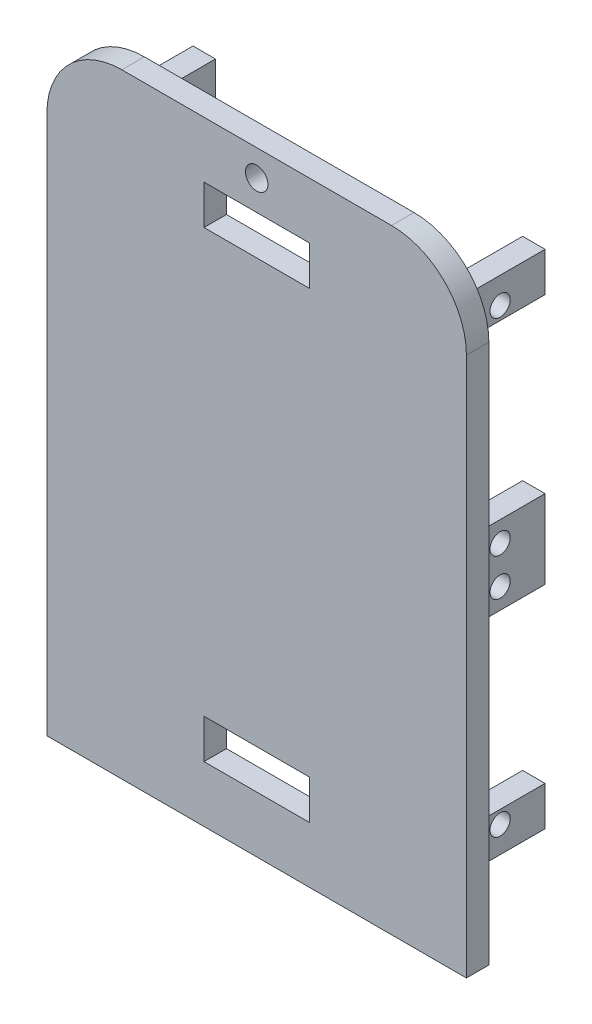
from build123d import *

# Parameters (mm, degrees)
SKETCH_1_W          = 48
SKETCH_1_H          = 67
EXTRUDE_2_DEPTH     = 3
SKETCH_3_W          = 3
SKETCH_3_H          = 67
SKETCH_3_H_2        = 66.995889348
EXTRUDE_3_DEPTH     = 12
SKETCH_4_R          = 1.35
SKETCH_4_W          = 12
SKETCH_4_H          = 23
CUT_EXTRUDE_1_DEPTH = 65
SKETCH_5_W          = 18.288137738
SKETCH_5_H          = 10.5
CUT_EXTRUDE_2_DEPTH = 65
SKETCH_6_W          = 3.5
SKETCH_6_H          = 67
SKETCH_6_W_2        = 0.25
CUT_EXTRUDE_3_DEPTH = 65
SKETCH_7_W          = 56
SKETCH_7_H          = 82
EXTRUDE_4_DEPTH     = 3
SKETCH_9_W          = 14.065102052
SKETCH_9_H          = 5.25
CUT_EXTRUDE_4_DEPTH = 3
SKETCH_10_R         = 1.5
CUT_EXTRUDE_5_DEPTH = 3
FILLET_2_R          = 10


with BuildPart() as part:
    # 草图1 → 凸台-拉伸2 (new body)
    with BuildSketch(Plane.XY):
        Rectangle(SKETCH_1_W, SKETCH_1_H)
    extrude(amount=EXTRUDE_2_DEPTH)

    # 草图3 → 凸台-拉伸3 (add)
    with BuildSketch(Plane(origin=(0, 0, 0), x_dir=(-1, 0, 0), z_dir=(0, 0, -1))):
        with Locations((-22, 0)):
            Rectangle(SKETCH_3_W, SKETCH_3_H)
        with Locations((22, 0.002055326)):
            Rectangle(SKETCH_3_W, SKETCH_3_H_2)
    extrude(amount=EXTRUDE_3_DEPTH)

    # 草图4 → 切除-拉伸1 (cut)
    with BuildSketch(Plane(origin=(23.5, 0, 0), x_dir=(0, 0, -1), z_dir=(1, 0, 0))):
        with Locations((6, 2.5)):
            Circle(SKETCH_4_R)
        with Locations((6, 30)):
            Circle(SKETCH_4_R)
        with Locations((6, -2.5)):
            Circle(SKETCH_4_R)
        with Locations((6, -30)):
            Circle(SKETCH_4_R)
        with Locations((6, -16.75)):
            Rectangle(SKETCH_4_W, SKETCH_4_H)
        with Locations((6, 16.75)):
            Rectangle(SKETCH_4_W, SKETCH_4_H)
    extrude(amount=-CUT_EXTRUDE_1_DEPTH, mode=Mode.SUBTRACT)

    # 草图5 → 切除-拉伸2 (cut)
    with BuildSketch(Plane(origin=(0, 0, 0), x_dir=(-1, 0, 0), z_dir=(0, 0, -1))):
        Rectangle(SKETCH_5_W, SKETCH_5_H)
    extrude(amount=-CUT_EXTRUDE_2_DEPTH, mode=Mode.SUBTRACT)

    # 草图6 → 切除-拉伸3 (cut)
    with BuildSketch(Plane(origin=(0, 0, 0), x_dir=(-1, 0, 0), z_dir=(0, 0, -1))):
        with Locations((22.25, 0)):
            Rectangle(SKETCH_6_W, SKETCH_6_H)
        with Locations((-23.875, 0)):
            Rectangle(SKETCH_6_W_2, SKETCH_6_H)
    extrude(amount=-CUT_EXTRUDE_3_DEPTH, mode=Mode.SUBTRACT)


with BuildPart() as cut_extrude_3_piece_1:
    # of the separate pieces the step leaves, piece 1, a body of its own (cut_extrude_3_pieces)
    add(part.part.solids().sort_by_distance((23.75, -33.5, 0))[0])

    # 草图7 → 凸台-拉伸4 (add)
    with BuildSketch(Plane.XY.offset(3)):
        Rectangle(SKETCH_7_W, SKETCH_7_H)
    extrude(amount=-EXTRUDE_4_DEPTH)

    # 草图9 → 切除-拉伸4 (cut)
    with BuildSketch(Plane(origin=(0, 0, 0), x_dir=(-1, 0, 0), z_dir=(0, 0, -1))):
        with Locations((0, 30.875)):
            Rectangle(SKETCH_9_W, SKETCH_9_H)
        Polygon((0, -28.25), (-7.032551026, -28.25), (-7.032551026, -33.5), (7.032551026, -33.5), (7.032551026, -28.25), align=None)
    extrude(amount=-CUT_EXTRUDE_4_DEPTH, mode=Mode.SUBTRACT)

    # 草图10 → 切除-拉伸5 (cut)
    with BuildSketch(Plane.XY.offset(3)):
        with Locations((0, 37.483485188)):
            Circle(SKETCH_10_R)
    extrude(amount=-CUT_EXTRUDE_5_DEPTH, mode=Mode.SUBTRACT)

    # 圆角2
    fillet_2_edges = [cut_extrude_3_piece_1.edges().sort_by_distance(p)[0] for p in [
        (-28, 41, 1.5),
        (28, 41, 1.5),
    ]]
    fillet(fillet_2_edges, radius=FILLET_2_R)


with BuildPart() as cut_extrude_3_piece_2:
    # of the separate pieces the step leaves, piece 2, a body of its own (cut_extrude_3_pieces)
    add(part.part.solids().sort_by_distance((-20.5, 5.25, -12))[0])


with BuildPart() as cut_extrude_3_piece_3:
    # of the separate pieces the step leaves, piece 3, a body of its own (cut_extrude_3_pieces)
    add(part.part.solids().sort_by_distance((-20.5, 33.5, -12))[0])


with BuildPart() as cut_extrude_3_piece_4:
    # of the separate pieces the step leaves, piece 4, a body of its own (cut_extrude_3_pieces)
    add(part.part.solids().sort_by_distance((-20.5, -28.25, -12))[0])


solid = Compound([cut_extrude_3_piece_1.part, cut_extrude_3_piece_2.part, cut_extrude_3_piece_3.part, cut_extrude_3_piece_4.part])
